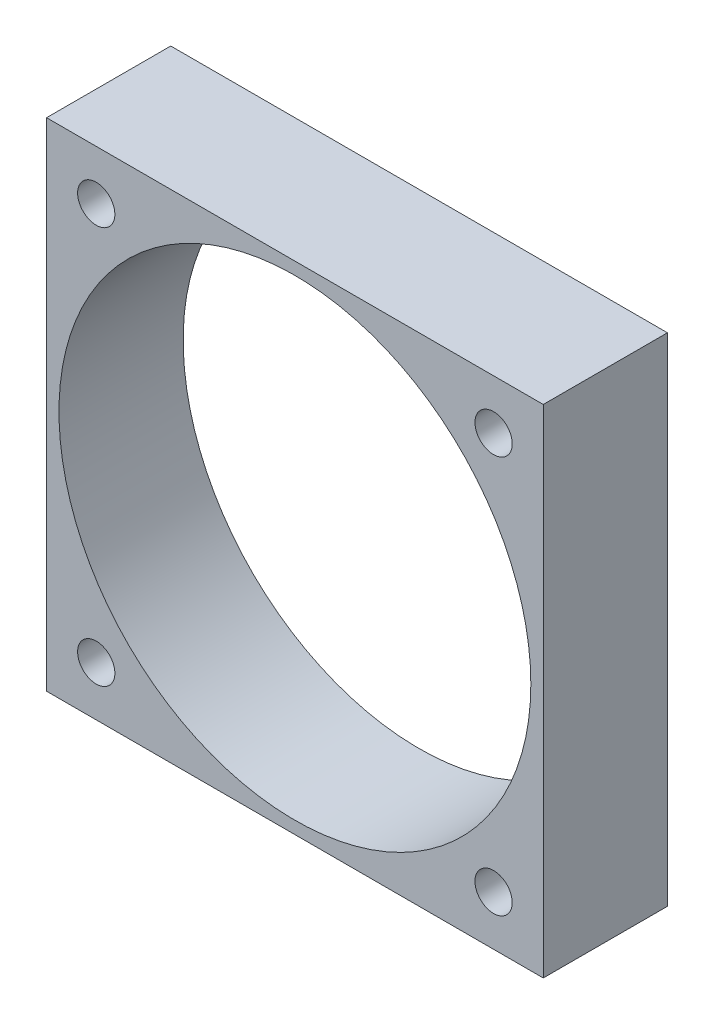
from build123d import *

# Parameters (mm, degrees)
ESBO_O1_W                = 40
ESBO_O1_H                = 40
ESBO_O1_R                = 1.5
ESBO_O1_R_2              = 19
RESSALTO_EXTRUS_O1_DEPTH = 10


with BuildPart() as part:
    # Esboço1 → Ressalto-extrusão1 (new body)
    with BuildSketch(Plane.XY):
        Rectangle(ESBO_O1_W, ESBO_O1_H)
        with Locations((-16, 16)):
            Circle(ESBO_O1_R, mode=Mode.SUBTRACT)
        with Locations((16, 16)):
            Circle(ESBO_O1_R, mode=Mode.SUBTRACT)
        with Locations((-16, -16)):
            Circle(ESBO_O1_R, mode=Mode.SUBTRACT)
        with Locations((16, -16)):
            Circle(ESBO_O1_R, mode=Mode.SUBTRACT)
        Circle(ESBO_O1_R_2, mode=Mode.SUBTRACT)
    extrude(amount=RESSALTO_EXTRUS_O1_DEPTH)


solid = part.part
